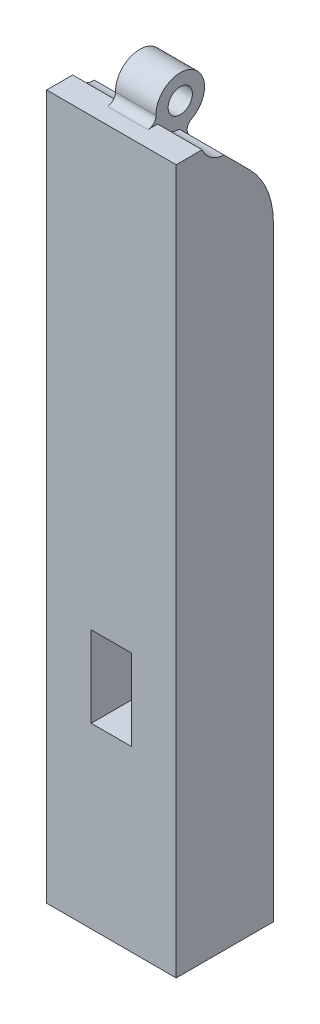
from build123d import *

# Parameters (mm, degrees)
SKETCH1_W               = 16
SKETCH1_H               = 87
BOSS_EXTRUDE2_DEPTH     = 12
CUT_EXTRUDE1_DEPTH      = 65.719189191
CUT_EXTRUDE1_DEPTH_BACK = 65.719189191
CUT_EXTRUDE2_DEPTH      = 65.719189191
CUT_EXTRUDE2_DEPTH_BACK = 65.719189191
SKETCH4_R               = 3
SKETCH4_R_2             = 1.5
BOSS_EXTRUDE3_DEPTH     = 2.5
FILLET1_R               = 1
FILLET2_R               = 10
SKETCH5_W               = 5
SKETCH5_H               = 10
SKETCH5_W_2             = 2.5
CUT_EXTRUDE3_DEPTH      = 5
CUT_EXTRUDE4_REACH      = 62.834
SKETCH6_W               = 5
SKETCH6_H               = 2.5
SKETCH7_W               = 5
SKETCH7_H               = 10
CUT_EXTRUDE5_DEPTH      = 65.719189191


with BuildPart() as part:
    # Sketch1 → Boss-Extrude2 (new body)
    with BuildSketch(Plane.XY):
        with Locations((0, -19.591785912)):
            Rectangle(SKETCH1_W, SKETCH1_H)
    extrude(amount=BOSS_EXTRUDE2_DEPTH)

    # Sketch2 → Cut-Extrude1 (cut, two sides: drawn at the far end of the back side and taken through both)
    with BuildSketch(Plane(origin=(0, 0, 0), x_dir=(0, 0, -1), z_dir=(1, 0, 0)).offset(-CUT_EXTRUDE1_DEPTH_BACK)):
        Polygon((0, 15.908214088), (0, 23.908214088), (-8, 23.908214088), align=None)
    extrude(amount=CUT_EXTRUDE1_DEPTH + CUT_EXTRUDE1_DEPTH_BACK, mode=Mode.SUBTRACT)

    # Sketch3 → Cut-Extrude2 (cut, two sides: drawn at the far end of the back side and taken through both)
    with BuildSketch(Plane(origin=(0, 0, 0), x_dir=(0, 0, -1), z_dir=(1, 0, 0)).offset(-CUT_EXTRUDE2_DEPTH_BACK)):
        with BuildLine():
            ThreePointArc((-3, 25.008214088), (-6.559834153, 27.955515518), (-8.791057147, 23.908214088))
            Line((-8.791057147, 23.908214088), (-7.019803903, 23.908214088))
            ThreePointArc((-7.019803903, 23.908214088), (-6.600122548, 26.382933306), (-4.5, 25.008214088))
            ThreePointArc((-4.5, 25.008214088), (-4.625280782, 24.40809154), (-4.980196097, 23.908214088))
            Line((-4.980196097, 23.908214088), (-3.208942853, 23.908214088))
            ThreePointArc((-3.208942853, 23.908214088), (-3.05269857, 24.448379935), (-3, 25.008214088))
        make_face()
        with BuildLine():
            Line((-7.019803903, 23.908214088), (-8.791057147, 23.908214088))
            ThreePointArc((-8.791057147, 23.908214088), (-6, 22.008214088), (-3.208942853, 23.908214088))
            Line((-3.208942853, 23.908214088), (-4.980196097, 23.908214088))
            ThreePointArc((-4.980196097, 23.908214088), (-6, 23.508214088), (-7.019803903, 23.908214088))
        make_face()
    extrude(amount=CUT_EXTRUDE2_DEPTH + CUT_EXTRUDE2_DEPTH_BACK, mode=Mode.SUBTRACT)

    # Sketch4 → Boss-Extrude3 (add, symmetric)
    with BuildSketch(Plane(origin=(0, 0, 0), x_dir=(0, 0, -1), z_dir=(1, 0, 0))):
        with Locations((-6, 25.008214088)):
            Circle(SKETCH4_R)
        with Locations((-6, 25.008214088)):
            Circle(SKETCH4_R_2, mode=Mode.SUBTRACT)
    extrude(amount=BOSS_EXTRUDE3_DEPTH, both=True)

    # Fillet1
    fillet1_edges = [part.edges().sort_by_distance(p)[0] for p in [
        (0, 22.009939252, 6.101725164),
        (0, 23.908214088, 8.791057147),
    ]]
    fillet(fillet1_edges, radius=FILLET1_R)

    # Fillet2
    fillet2_edges = [part.edges().sort_by_distance(p)[0] for p in [
        (0, 15.908214088, 0),
    ]]
    fillet(fillet2_edges, radius=FILLET2_R)

    # Sketch5 → Cut-Extrude3 (cut)
    with BuildSketch(Plane(origin=(0, 0, 0), x_dir=(-1, 0, 0), z_dir=(0, 0, -1))):
        with Locations((0, -16.091785912)):
            Rectangle(SKETCH5_W, SKETCH5_H)
        with Locations((1.25, -36.091785912)):
            Rectangle(SKETCH5_W_2, SKETCH5_H)
        with Locations((-1.25, -36.091785912)):
            Rectangle(SKETCH5_W_2, SKETCH5_H)
    extrude(amount=-CUT_EXTRUDE3_DEPTH, mode=Mode.SUBTRACT)

    # Sketch6 → Cut-Extrude4 (cut, up to next)
    with BuildSketch(Plane.XZ.offset(31.091785912), mode=Mode.PRIVATE) as cut_extrude4_sk1:
        with Locations((0, 3.75)):
            Rectangle(SKETCH6_W, SKETCH6_H)
    cut_extrude4_tool1 = extrude(cut_extrude4_sk1.sketch, amount=-CUT_EXTRUDE4_REACH, mode=Mode.PRIVATE) & part.part
    add(cut_extrude4_tool1.solids().sort_by_distance((0, -31.091786, 3.75))[0], mode=Mode.SUBTRACT)

    # Sketch7 → Cut-Extrude5 (cut, through all)
    with BuildSketch(Plane(origin=(0, 0, 0), x_dir=(-1, 0, 0), z_dir=(0, 0, -1))):
        with Locations((0, -36.091785912)):
            Rectangle(SKETCH7_W, SKETCH7_H)
    extrude(amount=-CUT_EXTRUDE5_DEPTH, mode=Mode.SUBTRACT)


solid = part.part
